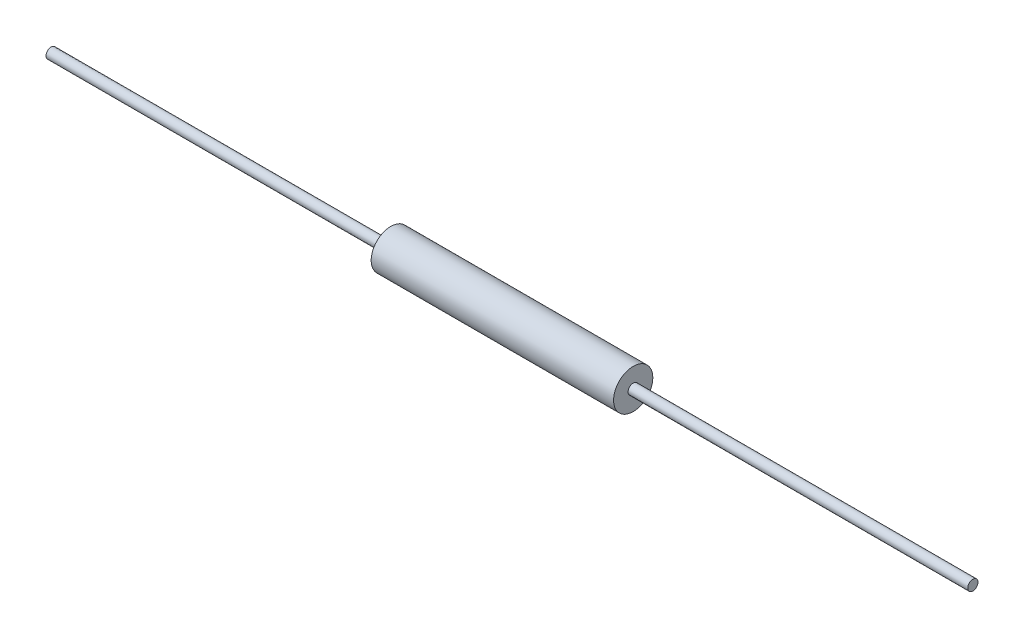
from build123d import *

# Parameters (mm, degrees)
SKETCH1_R           = 1.15
BOSS_EXTRUDE1_DEPTH = 14.2
SKETCH2_R           = 0.3
BOSS_EXTRUDE2_DEPTH = 19.9
BOSS_EXTRUDE3_START = 19.9
SKETCH3_R           = 0.3
BOSS_EXTRUDE3_DEPTH = 19.9


with BuildPart() as part:
    # Sketch1 → Boss-Extrude1 (new body)
    with BuildSketch(Plane(origin=(0, 0, 0), x_dir=(0, 0, -1), z_dir=(1, 0, 0))):
        Circle(SKETCH1_R)
    extrude(amount=BOSS_EXTRUDE1_DEPTH)

    # Sketch2 → Boss-Extrude2 (add)
    with BuildSketch(Plane(origin=(14.2, 0, 0), x_dir=(0, 0, -1), z_dir=(1, 0, 0))):
        Circle(SKETCH2_R)
    extrude(amount=BOSS_EXTRUDE2_DEPTH)

    # Sketch3 → Boss-Extrude3 (add)
    with BuildSketch(Plane.ZY.offset(BOSS_EXTRUDE3_START)):
        with Locations(Location((0, 0, 0), (0, 0, 180))):
            Circle(SKETCH3_R)
    extrude(amount=-BOSS_EXTRUDE3_DEPTH)


solid = part.part
